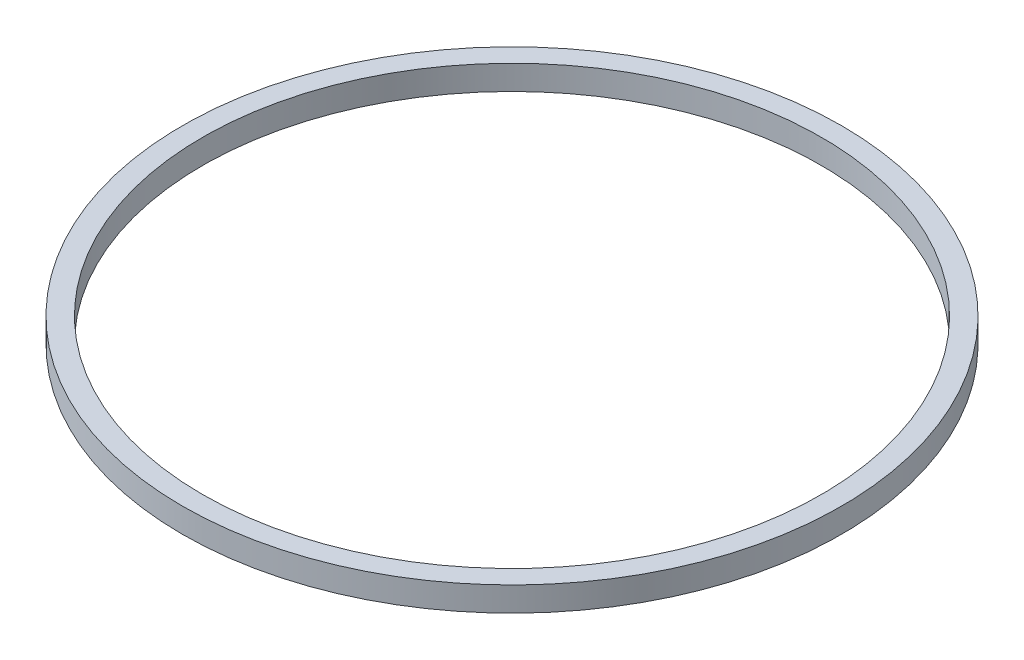
from build123d import *

# Parameters (mm, degrees)
SKETCH1_R           = 85.6234
SKETCH1_R_2         = 80.391
BOSS_EXTRUDE1_DEPTH = 6.35


with BuildPart() as part:
    # Sketch1 → Boss-Extrude1 (new body)
    with BuildSketch(Plane(origin=(0, 0, 0), x_dir=(1, 0, 0), z_dir=(0, 1, 0))):
        with Locations(Location((0, 0, 0), (0, 0, 270))):
            Circle(SKETCH1_R)
        with Locations(Location((0, 0, 0), (0, 0, 270))):
            Circle(SKETCH1_R_2, mode=Mode.SUBTRACT)
    extrude(amount=BOSS_EXTRUDE1_DEPTH)


solid = part.part
